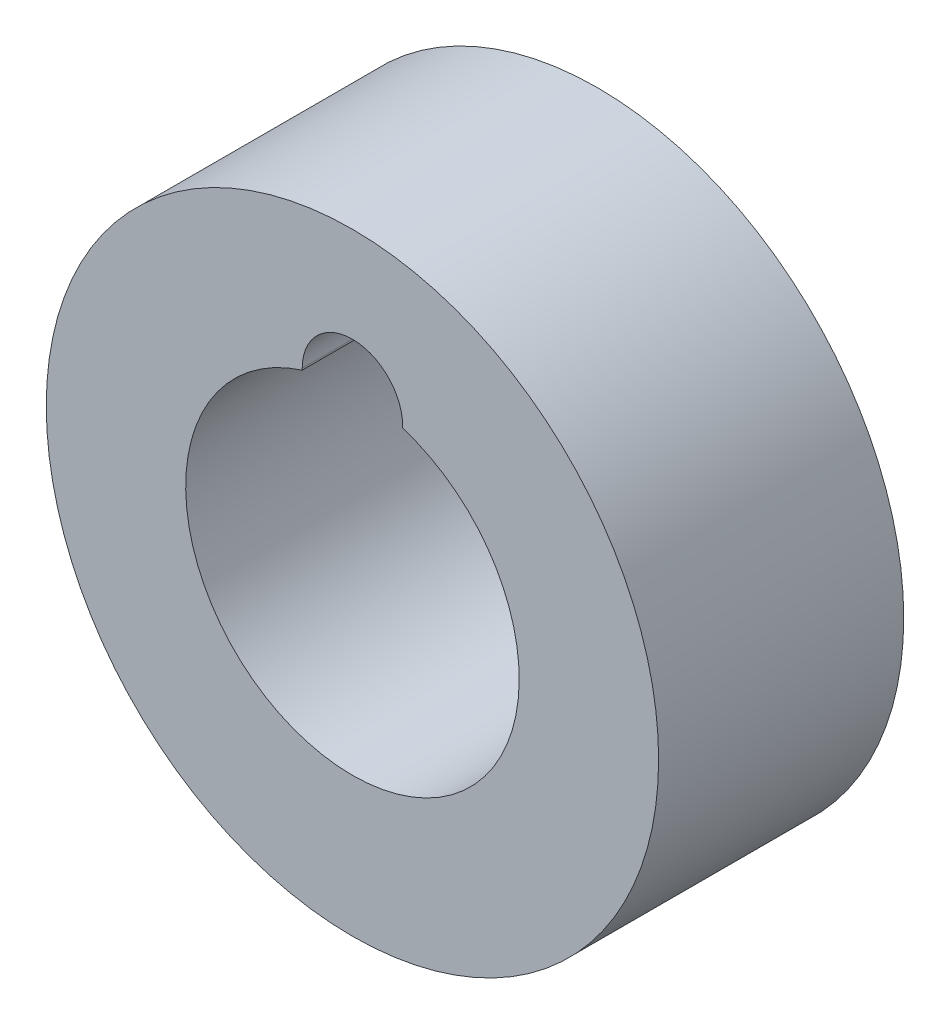
from build123d import *

# Parameters (mm, degrees)
CROQUIS1_R              = 7.62
CROQUIS1_R_2            = 4.15
SALIENTE_EXTRUIR1_DEPTH = 6.099999992
CORTAR_EXTRUIR1_DEPTH   = 13.383004478


with BuildPart() as part:
    # Croquis1 → Saliente-Extruir1 (new body)
    with BuildSketch(Plane.XY):
        with Locations(Location((0, 0, 0), (0, 0, 180))):
            Circle(CROQUIS1_R)
        with Locations(Location((0, 0, 0), (0, 0, 180))):
            Circle(CROQUIS1_R_2, mode=Mode.SUBTRACT)
    extrude(amount=SALIENTE_EXTRUIR1_DEPTH)

    # Croquis2 → Cortar-Extruir1 (cut, through all)
    with BuildSketch(Plane.XY.offset(6.099999992)):
        with BuildLine():
            Line((-1.25, 0), (-1.25, 4))
            ThreePointArc((-1.25, 4), (0, 5.25), (1.25, 4))
            Line((1.25, 4), (1.25, 0))
            ThreePointArc((1.25, 0), (0, -1.25), (-1.25, 0))
        make_face()
    extrude(amount=-CORTAR_EXTRUIR1_DEPTH, mode=Mode.SUBTRACT)


solid = part.part
